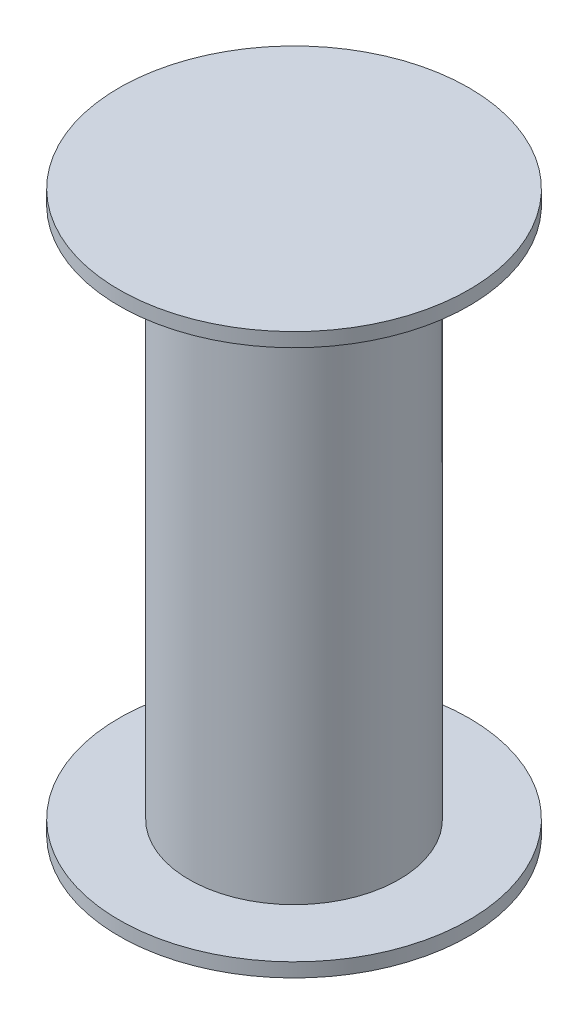
from build123d import *


with BuildPart() as part:
    # Esquisse1 → Révolution1 (revolve)
    with BuildSketch(Plane.XY, mode=Mode.PRIVATE) as r_volution1_sk:
        Polygon((0, -7.945652174), (0, -6.945652174), (0, 12.054347826), (0, 32.054347826), (-12.5, 32.054347826), (-12.5, 31.054347826), (-7.5, 31.054347826), (-7.5, -6.945652174), (-12.5, -6.945652174), (-12.5, -7.945652174), align=None)
    revolve(r_volution1_sk.sketch.rotate(Axis((0, -27.01473029, 0), (0, 1, 0)), 270), axis=Axis((0, -27.01473029, 0), (0, 1, 0)))


solid = part.part
